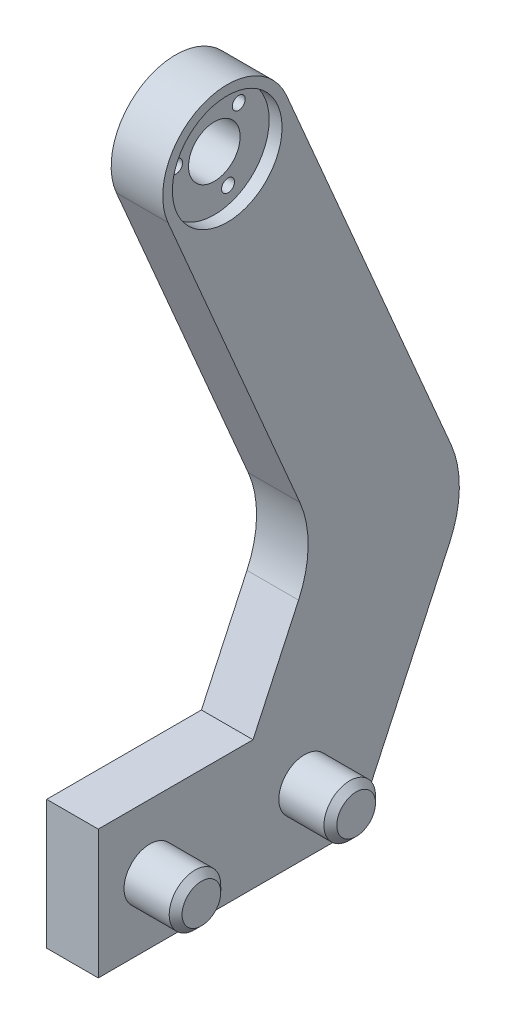
from build123d import *

# Parameters (mm, degrees)
BOSS_EXTRUDE1_DEPTH      = 88.9
CUT_EXTRUDE2_DEPTH       = 241.232341963
CUT_EXTRUDE2_DEPTH_BACK  = 241.232341963
SKETCH3_R                = 28.575
CUT_EXTRUDE5_DEPTH       = 28.575
CUT_EXTRUDE6_DEPTH       = 243.134084755
CUT_EXTRUDE6_DEPTH_BACK  = 243.134084755
SKETCH4_R                = 12.7
CUT_EXTRUDE7_DEPTH       = 261.369359036
CUT_EXTRUDE7_DEPTH_BACK  = 261.369359036
CUT_EXTRUDE8_DEPTH       = 261.369359036
CUT_EXTRUDE8_DEPTH_BACK  = 12.7
SKETCH6_R                = 9.525
SKETCH7_R                = 6.35
CUT_EXTRUDE9_DEPTH       = 12.7
SKETCH12_R               = 13.5
CUT_EXTRUDE13_DEPTH      = 3.175
CUT_EXTRUDE14_DEPTH      = 253.187753717
CUT_EXTRUDE14_DEPTH_BACK = 253.187753717
SKETCH14_R               = 1.5875
CUT_EXTRUDE15_DEPTH      = 261.369359036
CUT_EXTRUDE15_DEPTH_BACK = 261.369359036
SKETCH15_W               = 158.75
SKETCH15_H               = 174.625
SKETCH16_R               = 6.35
BOSS_EXTRUDE2_DEPTH      = 12.7
CHAMFER1_SIZE            = 1.5875


with BuildPart() as part:
    # Sketch1 → Boss-Extrude1 (new body)
    with BuildSketch(Plane.XY):
        Polygon((0, 0), (0, -174.625), (171.45, -174.625), (171.45, 0), (158.75, 0), (158.75, -142.875), (12.7, -142.875), (12.7, 0), align=None)
    extrude(amount=BOSS_EXTRUDE1_DEPTH)

    # Sketch2 → Cut-Extrude2 (cut, two sides: drawn at the far end of the back side and taken through both)
    with BuildSketch(Plane(origin=(0, -142.875, 0), x_dir=(1, 0, 0), z_dir=(0, 1, 0)).offset(-CUT_EXTRUDE2_DEPTH_BACK)):
        Polygon((158.75, 0), (12.7, 0), (12.7, -25.4), (85.724999876, -25.4), (158.75, -25.4), align=None)
    extrude(amount=CUT_EXTRUDE2_DEPTH + CUT_EXTRUDE2_DEPTH_BACK, mode=Mode.SUBTRACT)

    # Sketch3 → Cut-Extrude5 (cut)
    with BuildSketch(Plane.XZ.offset(174.625)):
        with Locations((85.725, 57.15)):
            Circle(SKETCH3_R)
    extrude(amount=-CUT_EXTRUDE5_DEPTH, mode=Mode.SUBTRACT)

    # Sketch4 → Cut-Extrude6 (cut, two sides: drawn at the far end of the back side and taken through both)
    with BuildSketch(Plane.XZ.offset(146.05).offset(-CUT_EXTRUDE6_DEPTH_BACK)):
        with Locations((85.725, 57.15)):
            Circle(SKETCH4_R)
    extrude(amount=CUT_EXTRUDE6_DEPTH + CUT_EXTRUDE6_DEPTH_BACK, mode=Mode.SUBTRACT)

    # Sketch5 → Cut-Extrude7 (cut, two sides: drawn at the far end of the back side and taken through both)
    with BuildSketch(Plane(origin=(171.45, 0, 0), x_dir=(0, 0, -1), z_dir=(1, 0, 0)).offset(-CUT_EXTRUDE7_DEPTH_BACK)):
        with BuildLine():
            Line((0, -174.625), (0, -114.3))
            ThreePointArc((0, -114.3), (-0.597344099, -119.776153781), (-2.361280333, -124.994736842))
            Line((-2.361280333, -124.994736842), (-25.4, -174.625))
            Line((-25.4, -174.625), (0, -174.625))
        make_face()
        with BuildLine():
            Line((-39.269490456, -98.025866748), (-71.745289975, -22.119448379))
            ThreePointArc((-71.745289975, -22.119448379), (-70.400400796, -7.131859618), (-57.149999966, 0))
            Line((-57.149999966, 0), (-88.9, 0))
            Line((-88.9, 0), (-88.9, -142.875))
            Line((-88.9, -142.875), (-50.8, -142.875))
            Line((-50.8, -142.875), (-39.583234749, -118.711720996))
            ThreePointArc((-39.583234749, -118.711720996), (-37.224875429, -108.402184034), (-39.269490456, -98.025866748))
        make_face()
        with BuildLine():
            Line((0, 0), (-57.149999966, 0))
            ThreePointArc((-57.149999966, 0), (-48.406859618, -2.624599204), (-42.554710025, -9.630551621))
            Line((-42.554710025, -9.630551621), (-2.047536041, -104.308882594))
            ThreePointArc((-2.047536041, -104.308882594), (-0.51714863, -109.200616928), (0, -114.3))
            Line((0, -114.3), (0, 0))
        make_face()
    extrude(amount=CUT_EXTRUDE7_DEPTH + CUT_EXTRUDE7_DEPTH_BACK, mode=Mode.SUBTRACT)

    # Sketch6 → Cut-Extrude8 (cut, two sides: drawn at the far end of the back side and taken through both)
    with BuildSketch(Plane(origin=(171.45, 0, 0), x_dir=(0, 0, -1), z_dir=(1, 0, 0)).offset(-CUT_EXTRUDE8_DEPTH_BACK)):
        with Locations(Location((-57.15, -15.875, 0), (0, 0, 90))):
            Circle(SKETCH6_R)
    extrude(amount=CUT_EXTRUDE8_DEPTH + CUT_EXTRUDE8_DEPTH_BACK, mode=Mode.SUBTRACT)

    # Sketch7 → Cut-Extrude9 (cut)
    with BuildSketch(Plane(origin=(12.7, 0, 0), x_dir=(0, 0, -1), z_dir=(1, 0, 0))):
        with Locations((-57.15, -15.875)):
            Circle(SKETCH7_R)
    extrude(amount=-CUT_EXTRUDE9_DEPTH, mode=Mode.SUBTRACT)

    # Sketch12 → Cut-Extrude13 (cut)
    with BuildSketch(Plane(origin=(12.7, 0, 0), x_dir=(0, 0, -1), z_dir=(1, 0, 0))):
        with Locations((-57.15, -15.875)):
            Circle(SKETCH12_R)
    extrude(amount=-CUT_EXTRUDE13_DEPTH, mode=Mode.SUBTRACT)

    # Sketch14 → Cut-Extrude14 (cut, two sides: drawn at the far end of the back side and taken through both)
    with BuildSketch(Plane(origin=(12.7, 0, 0), x_dir=(0, 0, -1), z_dir=(1, 0, 0)).offset(-CUT_EXTRUDE14_DEPTH_BACK)):
        with Locations((-53.770765225, -24.780413934)):
            Circle(SKETCH14_R)
        with Locations((-66.551932086, -14.348796194)):
            Circle(SKETCH14_R)
        with Locations((-51.12730269, -8.495789872)):
            Circle(SKETCH14_R)
    extrude(amount=CUT_EXTRUDE14_DEPTH + CUT_EXTRUDE14_DEPTH_BACK, mode=Mode.SUBTRACT)

    # Sketch15 → Cut-Extrude15 (cut, two sides: drawn at the far end of the back side and taken through both)
    with BuildSketch(Plane.XY.offset(88.9).offset(-CUT_EXTRUDE15_DEPTH_BACK)):
        with Locations((92.075, -87.3125)):
            Rectangle(SKETCH15_W, SKETCH15_H)
    extrude(amount=CUT_EXTRUDE15_DEPTH + CUT_EXTRUDE15_DEPTH_BACK, mode=Mode.SUBTRACT)

    # Sketch16 → Boss-Extrude2 (add)
    with BuildSketch(Plane(origin=(12.7, 0, 0), x_dir=(0, 0, -1), z_dir=(1, 0, 0))):
        with Locations(Location((-76.2, -158.75, 0), (0, 0, 180))):
            Circle(SKETCH16_R)
        with Locations(Location((-38.1, -158.75, 0), (0, 0, 180))):
            Circle(SKETCH16_R)
    extrude(amount=BOSS_EXTRUDE2_DEPTH)

    # Chamfer1
    chamfer1_edges = [part.edges().sort_by_distance(p)[0] for p in [
        (25.4, -158.75, 69.85),
        (25.4, -158.75, 31.75),
    ]]
    chamfer(chamfer1_edges, length=CHAMFER1_SIZE)


solid = part.part
